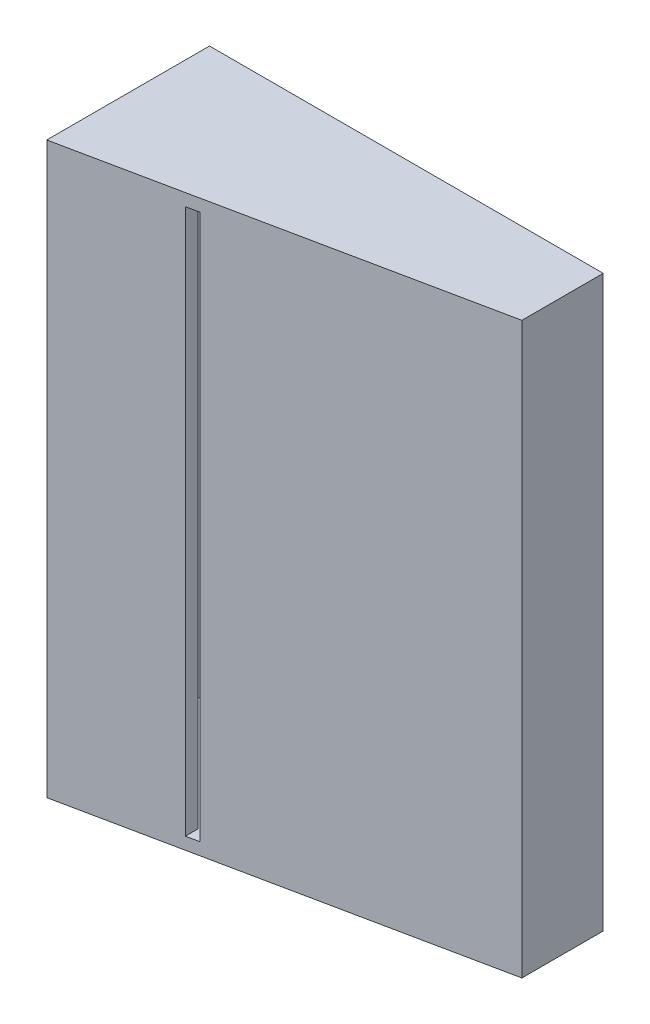
from build123d import *

# Parameters (mm, degrees)
SKETCH1_W           = 2.9
SKETCH1_H           = 19.8
BOSS_EXTRUDE1_DEPTH = 1.5
SKETCH2_W           = 22.5
SKETCH2_H           = 26
BOSS_EXTRUDE3_DEPTH = 1.5
BOSS_EXTRUDE4_DEPTH = 20
CUT_EXTRUDE1_DEPTH  = 70
CUT_EXTRUDE2_START  = -35
CUT_EXTRUDE2_DEPTH  = 33.5
CUT_EXTRUDE3_REACH  = 80.921
SKETCH6_W           = 1.5
SKETCH6_H           = 67


with BuildPart() as part:
    # Sketch1 → Boss-Extrude1 (new body)
    with BuildSketch(Plane.XY):
        with Locations((-45.437495374, 25.25)):
            Rectangle(SKETCH1_W, SKETCH1_H)
    extrude(amount=-BOSS_EXTRUDE1_DEPTH)

    # Sketch2 → Boss-Extrude3 (add)
    with BuildSketch(Plane(origin=(0, 0, -1.5), x_dir=(-1, 0, 0), z_dir=(0, 0, -1))):
        with Locations((35.637495374, 25.25)):
            Rectangle(SKETCH2_W, SKETCH2_H)
    extrude(amount=BOSS_EXTRUDE3_DEPTH)

    # Sketch3 → Boss-Extrude4 (add)
    with BuildSketch(Plane.XY):
        Polygon((-46.887495374, 15.25), (-46.887495374, 35.25), (-46.887495374, 60.25), (1.5, 60.25), (1.5, -9.75), (-46.887495374, -9.75), align=None)
    extrude(amount=BOSS_EXTRUDE4_DEPTH)

    # Sketch4 → Cut-Extrude1 (cut)
    with BuildSketch(Plane.XZ.offset(9.75)):
        Polygon((-46.887495374, 20), (1.5, 10), (1.5, 20), align=None)
    extrude(amount=-CUT_EXTRUDE1_DEPTH, mode=Mode.SUBTRACT)

    # Sketch5 → Cut-Extrude2 (cut)
    with BuildSketch(Plane.XZ.offset(9.75).offset(CUT_EXTRUDE2_START)):
        Polygon((0, 1.5), (0, 8.778299559), (-46.887495374, 18.468302113), (-46.887495374, 1.5), align=None)
    cut_extrude2 = extrude(amount=CUT_EXTRUDE2_DEPTH, mode=Mode.SUBTRACT)

    # Mirror1: Cut-Extrude2 across plane
    add(cut_extrude2.mirror(Plane.ZX.offset(25.25)), mode=Mode.SUBTRACT)

    # Cut-Extrude3: up to this plane
    cut_extrude3_end = Plane(origin=(-46.887495374, 109.660016278, 20), z_dir=(-0.2023881138557791, 0, -0.979305392290832))
    # Sketch6 → Cut-Extrude3 (cut, up to the surface)
    with BuildSketch(Plane(origin=(0, 0, 0), x_dir=(-1, 0, 0), z_dir=(0, 0, -1)), mode=Mode.PRIVATE) as cut_extrude3_sk1:
        with Locations((32.02, 25.25)):
            Rectangle(SKETCH6_W, SKETCH6_H)
    cut_extrude3_tool1 = split(extrude(cut_extrude3_sk1.sketch, amount=-CUT_EXTRUDE3_REACH, mode=Mode.PRIVATE), bisect_by=cut_extrude3_end, keep=Keep.BOTH, mode=Mode.PRIVATE)
    add(cut_extrude3_tool1.solids().sort_by_distance((-32.02, 25.25, 0))[0], mode=Mode.SUBTRACT)


solid = part.part
